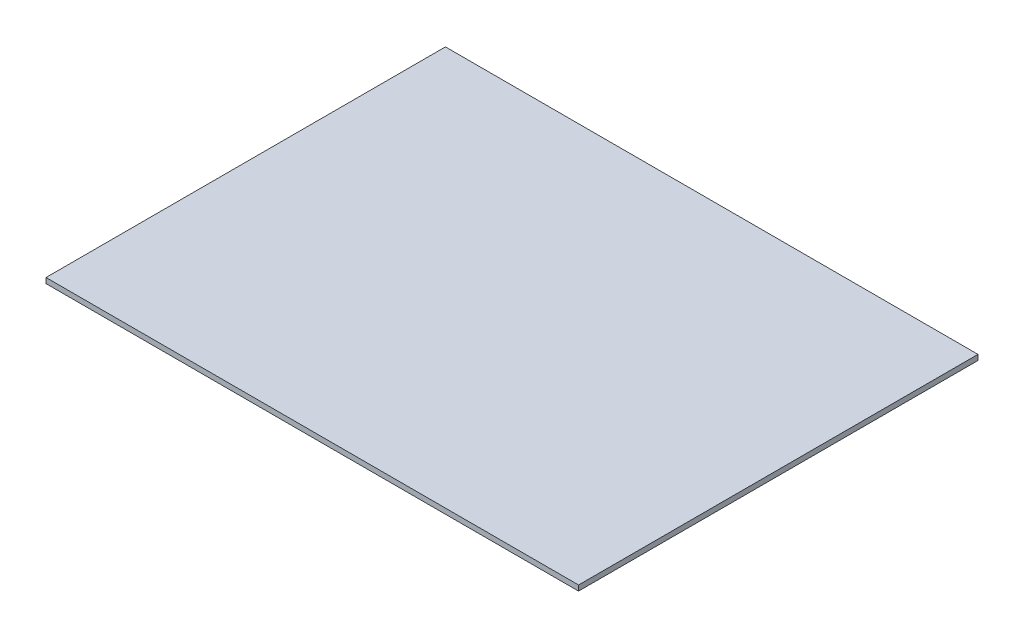
from build123d import *

# Parameters (mm, degrees)
SKETCH1_W           = 200
SKETCH1_H           = 150
BOSS_EXTRUDE1_DEPTH = 2


with BuildPart() as part:
    # Sketch1 → Boss-Extrude1 (new body)
    with BuildSketch(Plane(origin=(0, 0, 0), x_dir=(1, 0, 0), z_dir=(0, 1, 0))):
        with Locations((100, 75)):
            Rectangle(SKETCH1_W, SKETCH1_H)
    extrude(amount=BOSS_EXTRUDE1_DEPTH)


solid = part.part
